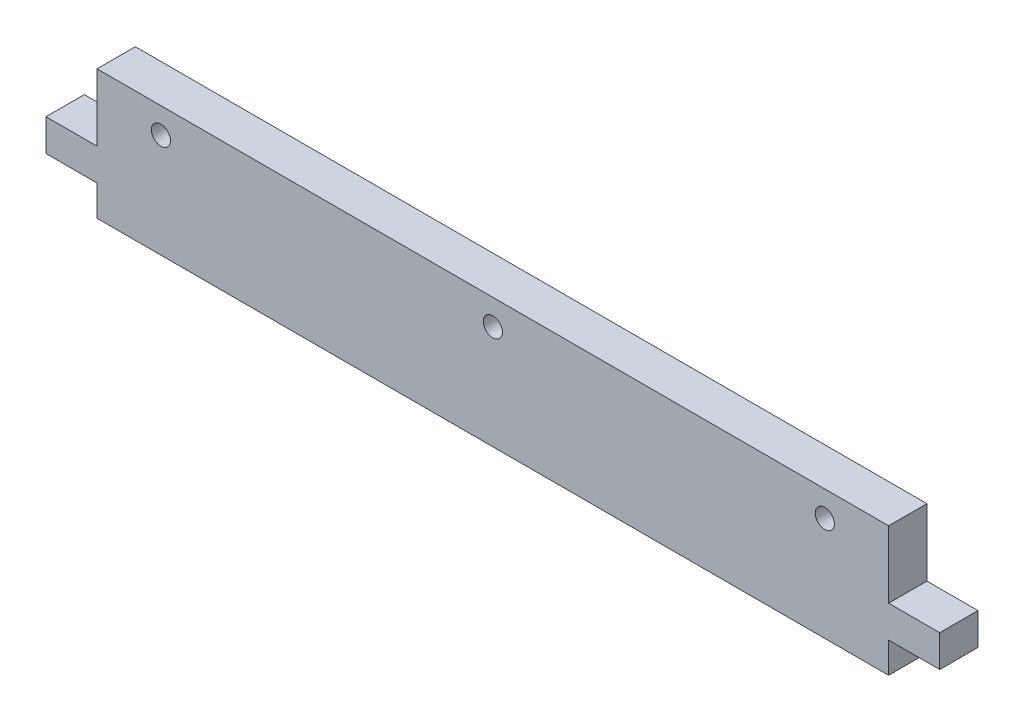
from build123d import *

# Parameters (mm, degrees)
SKETCH_1_W          = 124
SKETCH_1_H          = 20.28
EXTRUDE_1_DEPTH     = 6
SKETCH_2_W          = 8
SKETCH_2_H          = 5
EXTRUDE_2_DEPTH     = 6
SKETCH_3_R          = 1.5
CUT_EXTRUDE_1_DEPTH = 134.683500852


with BuildPart() as part:
    # 草图1 → 凸台-拉伸1 (new body)
    with BuildSketch(Plane.XY):
        with Locations((62, 10.14)):
            Rectangle(SKETCH_1_W, SKETCH_1_H)
    extrude(amount=EXTRUDE_1_DEPTH)

    # 草图2 → 凸台-拉伸2 (add)
    with BuildSketch(Plane.XY.offset(6)):
        with Locations((-4, 7.28)):
            Rectangle(SKETCH_2_W, SKETCH_2_H)
        with Locations((128, 7.28)):
            Rectangle(SKETCH_2_W, SKETCH_2_H)
    extrude(amount=-EXTRUDE_2_DEPTH)

    # 草图3 → 切除-拉伸1 (cut, through all)
    with BuildSketch(Plane(origin=(0, 0, 0), x_dir=(-1, 0, 0), z_dir=(0, 0, -1))):
        with Locations((-62, 16.28)):
            Circle(SKETCH_3_R)
        with Locations((-114, 16.28)):
            Circle(SKETCH_3_R)
        with Locations((-10, 16.28)):
            Circle(SKETCH_3_R)
    extrude(amount=-CUT_EXTRUDE_1_DEPTH, mode=Mode.SUBTRACT)


solid = part.part
